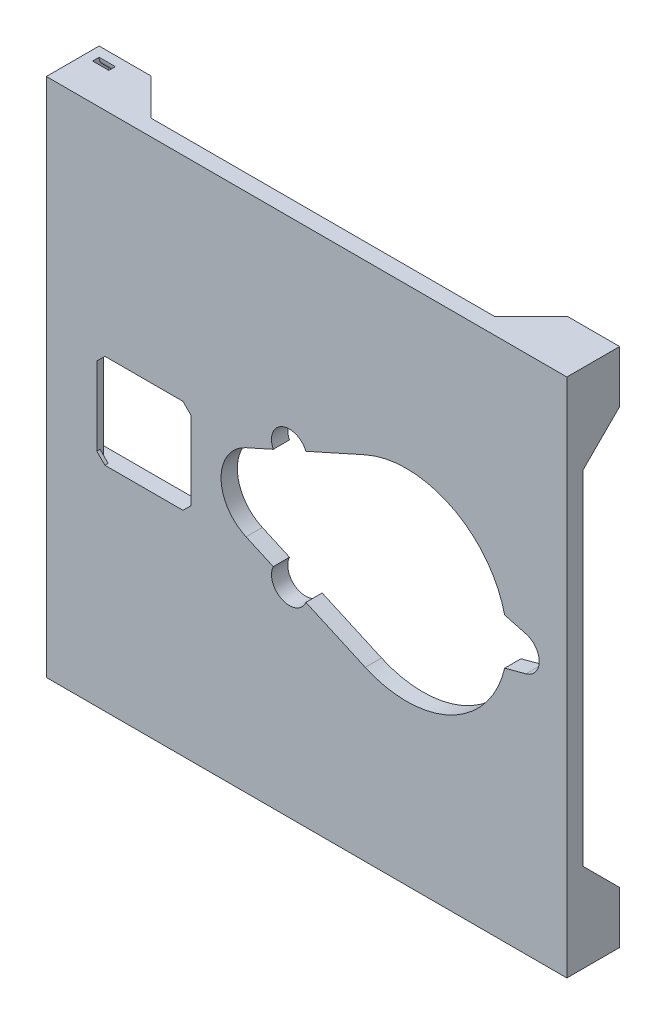
from build123d import *

# Parameters (mm, degrees)
SKETCH1_W           = 160
SKETCH1_H           = 160
SKETCH1_W_2         = 29
SKETCH1_H_2         = 29
BOSS_EXTRUDE1_DEPTH = 5
BOSS_EXTRUDE2_DEPTH = 1
SKETCH5_W           = 5
SKETCH5_H           = 29
CUT_EXTRUDE2_DEPTH  = 3
BOSS_EXTRUDE3_DEPTH = 11.22
BOSS_EXTRUDE5_DEPTH = 6.47787
BOSS_EXTRUDE6_DEPTH = 6.47787
BOSS_EXTRUDE7_DEPTH = 6.47787
BOSS_EXTRUDE8_DEPTH = 6.47787
SKETCH16_W          = 180
SKETCH16_H          = 180
SKETCH16_W_2        = 160
SKETCH16_H_2        = 160
CUT_EXTRUDE3_DEPTH  = 47
SKETCH18_W          = 5
SKETCH18_H          = 2
SKETCH19_W          = 5
SKETCH19_H          = 2


with BuildPart() as part:
    # Sketch1 → Boss-Extrude1 (new body)
    with BuildSketch(Plane(origin=(0, 0, 0), x_dir=(0, 1, 0), z_dir=(0, 0, 1))):
        with Locations((80, 80)):
            Rectangle(SKETCH1_W, SKETCH1_H)
        with BuildLine():
            Line((68.137582786, 98.618181818), (64.387982104, 90.254547554))
            ThreePointArc((64.387982104, 90.254547554), (56.981285025, 87.55), (59.88970449, 80.220959455))
            Line((59.88970449, 80.220959455), (51.712697414, 61.981818182))
            ThreePointArc((51.712697414, 61.981818182), (52.218398749, 35.545632261), (72.935219616, 19.115751158))
            Line((72.935219616, 19.115751158), (74.687407955, 12.576495252))
            ThreePointArc((74.687407955, 12.576495252), (80, 8.5), (85.312592045, 12.576495252))
            Line((85.312592045, 12.576495252), (87.064780384, 19.115751158))
            ThreePointArc((87.064780384, 19.115751158), (107.781601251, 35.545632261), (108.287302586, 61.981818182))
            Line((108.287302586, 61.981818182), (100.11029551, 80.220959455))
            ThreePointArc((100.11029551, 80.220959455), (103.018714975, 87.55), (95.612017896, 90.254547554))
            Line((95.612017896, 90.254547554), (91.862417214, 98.618181818))
            ThreePointArc((91.862417214, 98.618181818), (80, 106.3), (68.137582786, 98.618181818))
        make_face(mode=Mode.SUBTRACT)
        with Locations((80, 130)):
            Rectangle(SKETCH1_W_2, SKETCH1_H_2, mode=Mode.SUBTRACT)
    extrude(amount=BOSS_EXTRUDE1_DEPTH)

    # Sketch3 → Boss-Extrude2 (add)
    with BuildSketch(Plane.XY.offset(5)):
        Polygon((-144.5, 92), (-142, 94.5), (-144.5, 94.5), align=None)
        Polygon((-144.5, 65.5), (-142, 65.5), (-144.5, 68), align=None)
        Polygon((-115.5, 65.5), (-118, 65.5), (-115.5, 68), align=None)
        Polygon((-115.5, 94.5), (-115.5, 92), (-118, 94.5), align=None)
    extrude(amount=-BOSS_EXTRUDE2_DEPTH)

    # Sketch5 → Cut-Extrude2 (cut)
    with BuildSketch(Plane(origin=(0, 0, 0), x_dir=(1, 0, 0), z_dir=(0, 0, -1))):
        with Locations((-147, -80)):
            Rectangle(SKETCH5_W, SKETCH5_H)
    extrude(amount=-CUT_EXTRUDE2_DEPTH, mode=Mode.SUBTRACT)

    # Sketch6 → Boss-Extrude3 (add)
    with BuildSketch(Plane(origin=(0, 0, 0), x_dir=(1, 0, 0), z_dir=(0, 0, -1))):
        Polygon((-160, -16), (-160, 0), (-144, 0), align=None)
        Polygon((-144, -160), (-160, -160), (-160, -144), align=None)
        Polygon((0, -160), (-16, -160), (0, -144), align=None)
        Polygon((0, 0), (-16, 0), (0, -16), align=None)
    extrude(amount=BOSS_EXTRUDE3_DEPTH)

    # Sketch12 → Boss-Extrude5 (add)
    with BuildSketch(Plane(origin=(44.26, 44.26, 44.26), x_dir=(0.8164965809277263, -0.40824829046386296, -0.4082482904638628), z_dir=(0.5773502691896256, 0.5773502691896261, 0.5773502691896258))):
        Polygon((-54.207208008, 93.889638406), (-87.544763407, 113.13708499), (-73.80312595, 121.070823075), (-54.207208008, 109.757114576), align=None)
    extrude(amount=BOSS_EXTRUDE5_DEPTH)

    # Sketch13 → Boss-Extrude6 (add)
    with BuildSketch(Plane(origin=(-97.593333333, 97.593333333, 97.593333333), x_dir=(0.4082482904638652, -0.4082482904638646, 0.8164965809277241), z_dir=(-0.577350269189624, 0.5773502691896251, 0.5773502691896285))):
        Polygon((-133.268571939, 11.313708499), (-119.526934482, 19.247446584), (-119.526934482, -19.247446584), (-133.268571939, -11.313708499), align=None)
    extrude(amount=BOSS_EXTRUDE6_DEPTH)

    # Sketch14 → Boss-Extrude7 (add)
    with BuildSketch(Plane(origin=(-44.26, -44.26, 44.26), x_dir=(0.40824829046386135, 0.40824829046386096, 0.8164965809277279), z_dir=(-0.5773502691896302, -0.5773502691896242, 0.5773502691896232))):
        Polygon((-54.207208008, 132.384531574), (-67.948845465, 124.450793489), (-67.948845465, 101.823376491), (-54.207208008, 93.889638406), align=None)
    extrude(amount=BOSS_EXTRUDE7_DEPTH)

    # Sketch15 → Boss-Extrude8 (add)
    with BuildSketch(Plane(origin=(-9.073333333, 9.073333333, -9.073333333), x_dir=(-0.8164965809277261, -0.40824829046386324, 0.40824829046386274), z_dir=(0.5773502691896257, -0.5773502691896257, 0.577350269189626))):
        Polygon((-11.112518466, -19.247446584), (22.225036933, 0), (8.483399476, 7.933738085), (-11.112518466, -3.379970414), align=None)
    extrude(amount=BOSS_EXTRUDE8_DEPTH)

    # Sketch16 → Cut-Extrude3 (cut)
    with BuildSketch(Plane.XY.offset(5)):
        with Locations((-80, 80)):
            Rectangle(SKETCH16_W, SKETCH16_H)
        with Locations((-80, 80)):
            Rectangle(SKETCH16_W_2, SKETCH16_H_2, mode=Mode.SUBTRACT)
    extrude(amount=-CUT_EXTRUDE3_DEPTH, mode=Mode.SUBTRACT)

    # Sketch18 → Cut-Revolve1 (revolve, cut)
    with BuildSketch(Plane(origin=(0, 0, -11.22), x_dir=(1, 0, 0), z_dir=(0, 0, -1))):
        with Locations((-5.5, -4)):
            Rectangle(SKETCH18_W, SKETCH18_H)
    revolve(axis=Axis((0, 0, -11.22), (-1, 0, 0)), mode=Mode.SUBTRACT)

    # Sketch19 → Cut-Revolve2 (revolve, cut)
    with BuildSketch(Plane(origin=(0, 0, -11.22), x_dir=(1, 0, 0), z_dir=(0, 0, -1))):
        with Locations((-154.5, -156)):
            Rectangle(SKETCH19_W, SKETCH19_H)
    revolve(axis=Axis((-160, 160, -11.22), (1, 0, 0)), mode=Mode.SUBTRACT)


solid = part.part
